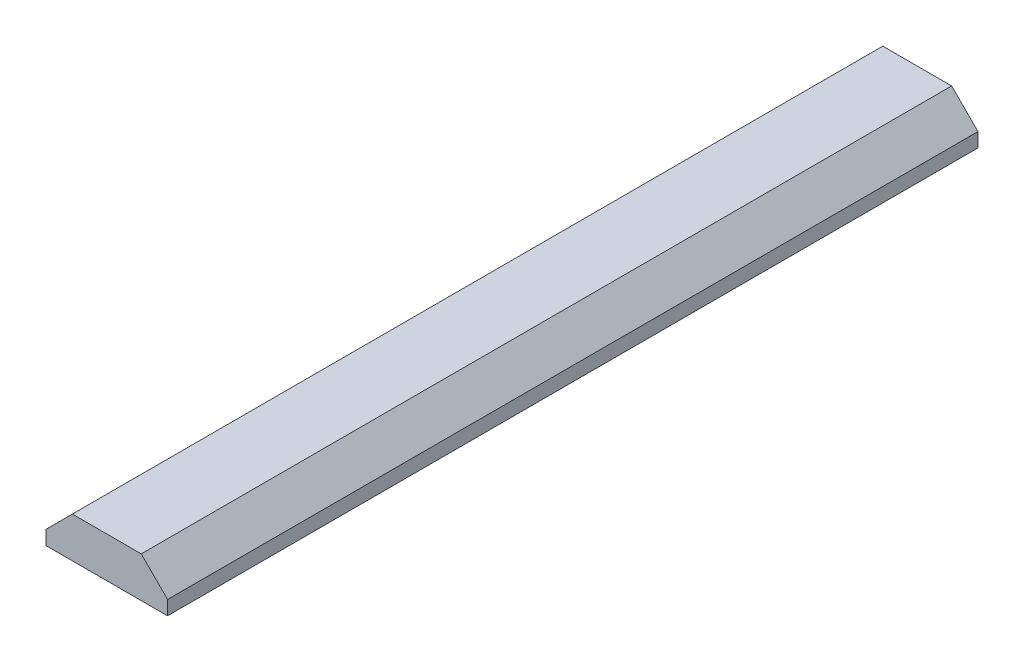
from build123d import *

# Parameters (mm, degrees)
AUFSATZ_LINEAR_AUSTRAGEN1_DEPTH = 80


with BuildPart() as part:
    # Skizze1 → Aufsatz-Linear austragen1 (new body)
    with BuildSketch(Plane.XY):
        Polygon((3.4, 1.808858787), (-3.4, 1.808858787), (-6, -0.791141213), (-6, -2.191141213), (6, -2.191141213), (6, -0.791141213), align=None)
    extrude(amount=AUFSATZ_LINEAR_AUSTRAGEN1_DEPTH)


solid = part.part
